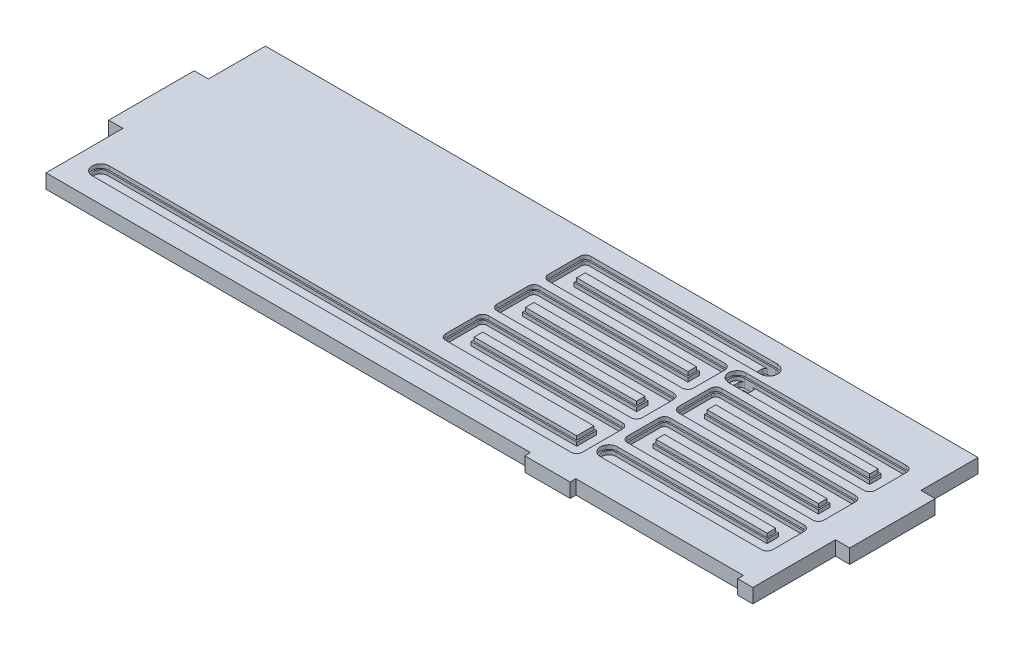
from build123d import *

# Parameters (mm, degrees)
EXTRUDE_1_DEPTH     = 50
CUT_EXTRUDE_1_DEPTH = 14
CUT_EXTRUDE_3_DEPTH = 27
CUT_EXTRUDE_4_DEPTH = 45
CUT_EXTRUDE_6_DEPTH = 50


with BuildPart() as part:
    # 草图1 → 凸台-拉伸1 (new body)
    with BuildSketch(Plane(origin=(0, 0, 0), x_dir=(1, 0, 0), z_dir=(0, 1, 0))):
        Polygon((0, 0), (0, -200), (-50, -200), (-50, -500), (0, -500), (0, -770), (1700, -770), (1700, -790), (1859, -790), (1859, -770), (2447, -770), (2447, -790), (2500, -790), (2500, -500), (2550, -500), (2550, -200), (2500, -200), (2500, 0), align=None)
    extrude(amount=-EXTRUDE_1_DEPTH)

    # 草图1<3> → 切除-拉伸1 (cut)
    with BuildSketch(Plane(origin=(0, 0, 0), x_dir=(1, 0, 0), z_dir=(0, 1, 0))):
        with BuildLine():
            Line((90, -698), (1770, -698))
            ThreePointArc((1770, -698), (1784.142135624, -692.142135624), (1790, -678))
            Line((1790, -678), (1790, -538))
            ThreePointArc((1790, -538), (1784.142135624, -523.857864376), (1770, -518))
            Line((1770, -518), (1250, -518))
            Line((1250, -518), (1250, -488))
            Line((1250, -488), (1770, -488))
            ThreePointArc((1770, -488), (1784.142135624, -482.142135624), (1790, -468))
            Line((1790, -468), (1790, -358))
            ThreePointArc((1790, -358), (1784.142135624, -343.857864376), (1770, -338))
            Line((1770, -338), (1250, -338))
            Line((1250, -338), (1250, -308))
            Line((1250, -308), (1770, -308))
            ThreePointArc((1770, -308), (1784.142135624, -302.142135624), (1790, -288))
            Line((1790, -288), (1790, -178))
            ThreePointArc((1790, -178), (1784.142135624, -163.857864376), (1770, -158))
            Line((1770, -158), (1250, -158))
            Line((1250, -158), (1250, -128))
            Line((1250, -128), (1865, -128))
            ThreePointArc((1865, -128), (1895, -98), (1865, -68))
            Line((1865, -68), (1210, -68))
            ThreePointArc((1210, -68), (1195.857864376, -73.857864376), (1190, -88))
            Line((1190, -88), (1190, -198))
            ThreePointArc((1190, -198), (1195.857864376, -212.142135624), (1210, -218))
            Line((1210, -218), (1730, -218))
            Line((1730, -218), (1730, -248))
            Line((1730, -248), (1210, -248))
            ThreePointArc((1210, -248), (1195.857864376, -253.857864376), (1190, -268))
            Line((1190, -268), (1190, -378))
            ThreePointArc((1190, -378), (1195.857864376, -392.142135624), (1210, -398))
            Line((1210, -398), (1730, -398))
            Line((1730, -398), (1730, -428))
            Line((1730, -428), (1210, -428))
            ThreePointArc((1210, -428), (1195.857864376, -433.857864376), (1190, -448))
            Line((1190, -448), (1190, -558))
            ThreePointArc((1190, -558), (1195.857864376, -572.142135624), (1210, -578))
            Line((1210, -578), (1730, -578))
            Line((1730, -578), (1730, -638))
            Line((1730, -638), (90, -638))
            ThreePointArc((90, -638), (60, -668), (90, -698))
        make_face()
        with BuildLine():
            Line((1835, -210), (2360, -210))
            Line((2360, -210), (2360, -240))
            Line((2360, -240), (1840, -240))
            ThreePointArc((1840, -240), (1825.857864376, -245.857864376), (1820, -260))
            Line((1820, -260), (1820, -370))
            ThreePointArc((1820, -370), (1825.857864376, -384.142135624), (1840, -390))
            Line((1840, -390), (2360, -390))
            Line((2360, -390), (2360, -420))
            Line((2360, -420), (1840, -420))
            ThreePointArc((1840, -420), (1825.857864376, -425.857864376), (1820, -440))
            Line((1820, -440), (1820, -550))
            ThreePointArc((1820, -550), (1825.857864376, -564.142135624), (1840, -570))
            Line((1840, -570), (2360, -570))
            Line((2360, -570), (2360, -600))
            Line((2360, -600), (1835, -600))
            ThreePointArc((1835, -600), (1805, -630), (1835, -660))
            Line((1835, -660), (2400, -660))
            ThreePointArc((2400, -660), (2414.142135624, -654.142135624), (2420, -640))
            Line((2420, -640), (2420, -530))
            ThreePointArc((2420, -530), (2414.142135624, -515.857864376), (2400, -510))
            Line((2400, -510), (1880, -510))
            Line((1880, -510), (1880, -480))
            Line((1880, -480), (2400, -480))
            ThreePointArc((2400, -480), (2414.142135624, -474.142135624), (2420, -460))
            Line((2420, -460), (2420, -350))
            ThreePointArc((2420, -350), (2414.142135624, -335.857864376), (2400, -330))
            Line((2400, -330), (1880, -330))
            Line((1880, -330), (1880, -300))
            Line((1880, -300), (2400, -300))
            ThreePointArc((2400, -300), (2414.142135624, -294.142135624), (2420, -280))
            Line((2420, -280), (2420, -170))
            ThreePointArc((2420, -170), (2414.142135624, -155.857864376), (2400, -150))
            Line((2400, -150), (1835, -150))
            ThreePointArc((1835, -150), (1805, -180), (1835, -210))
        make_face()
    extrude(amount=-CUT_EXTRUDE_1_DEPTH, mode=Mode.SUBTRACT)

    # 草图1<5> → 切除-拉伸3 (cut)
    with BuildSketch(Plane(origin=(0, 0, 0), x_dir=(1, 0, 0), z_dir=(0, 1, 0))):
        with BuildLine():
            Line((90, -693), (1770, -693))
            ThreePointArc((1770, -693), (1780.606601718, -688.606601718), (1785, -678))
            Line((1785, -678), (1785, -538))
            ThreePointArc((1785, -538), (1780.606601718, -527.393398282), (1770, -523))
            Line((1770, -523), (1245, -523))
            Line((1245, -523), (1245, -483))
            Line((1245, -483), (1770, -483))
            ThreePointArc((1770, -483), (1780.606601718, -478.606601718), (1785, -468))
            Line((1785, -468), (1785, -358))
            ThreePointArc((1785, -358), (1780.606601718, -347.393398282), (1770, -343))
            Line((1770, -343), (1245, -343))
            Line((1245, -343), (1245, -303))
            Line((1245, -303), (1770, -303))
            ThreePointArc((1770, -303), (1780.606601718, -298.606601718), (1785, -288))
            Line((1785, -288), (1785, -178))
            ThreePointArc((1785, -178), (1780.606601718, -167.393398282), (1770, -163))
            Line((1770, -163), (1245, -163))
            Line((1245, -163), (1245, -123))
            Line((1245, -123), (1865, -123))
            ThreePointArc((1865, -123), (1890, -98), (1865, -73))
            Line((1865, -73), (1210, -73))
            ThreePointArc((1210, -73), (1199.393398282, -77.393398282), (1195, -88))
            Line((1195, -88), (1195, -198))
            ThreePointArc((1195, -198), (1199.393398282, -208.606601718), (1210, -213))
            Line((1210, -213), (1735, -213))
            Line((1735, -213), (1735, -253))
            Line((1735, -253), (1210, -253))
            ThreePointArc((1210, -253), (1199.393398282, -257.393398282), (1195, -268))
            Line((1195, -268), (1195, -378))
            ThreePointArc((1195, -378), (1199.393398282, -388.606601718), (1210, -393))
            Line((1210, -393), (1735, -393))
            Line((1735, -393), (1735, -433))
            Line((1735, -433), (1210, -433))
            ThreePointArc((1210, -433), (1199.393398282, -437.393398282), (1195, -448))
            Line((1195, -448), (1195, -558))
            ThreePointArc((1195, -558), (1199.393398282, -568.606601718), (1210, -573))
            Line((1210, -573), (1735, -573))
            Line((1735, -573), (1735, -643))
            Line((1735, -643), (90, -643))
            ThreePointArc((90, -643), (65, -668), (90, -693))
        make_face()
        with BuildLine():
            Line((1835, -155), (2400, -155))
            ThreePointArc((2400, -155), (2410.606601718, -159.393398282), (2415, -170))
            Line((2415, -170), (2415, -280))
            ThreePointArc((2415, -280), (2410.606601718, -290.606601718), (2400, -295))
            Line((2400, -295), (1875, -295))
            Line((1875, -295), (1875, -335))
            Line((1875, -335), (2400, -335))
            ThreePointArc((2400, -335), (2410.606601718, -339.393398282), (2415, -350))
            Line((2415, -350), (2415, -460))
            ThreePointArc((2415, -460), (2410.606601718, -470.606601718), (2400, -475))
            Line((2400, -475), (1875, -475))
            Line((1875, -475), (1875, -515))
            Line((1875, -515), (2400, -515))
            ThreePointArc((2400, -515), (2410.606601718, -519.393398282), (2415, -530))
            Line((2415, -530), (2415, -640))
            ThreePointArc((2415, -640), (2410.606601718, -650.606601718), (2400, -655))
            Line((2400, -655), (1835, -655))
            ThreePointArc((1835, -655), (1810, -630), (1835, -605))
            Line((1835, -605), (2365, -605))
            Line((2365, -605), (2365, -565))
            Line((2365, -565), (1840, -565))
            ThreePointArc((1840, -565), (1829.393398282, -560.606601718), (1825, -550))
            Line((1825, -550), (1825, -440))
            ThreePointArc((1825, -440), (1829.393398282, -429.393398282), (1840, -425))
            Line((1840, -425), (2365, -425))
            Line((2365, -425), (2365, -385))
            Line((2365, -385), (1840, -385))
            ThreePointArc((1840, -385), (1829.393398282, -380.606601718), (1825, -370))
            Line((1825, -370), (1825, -260))
            ThreePointArc((1825, -260), (1829.393398282, -249.393398282), (1840, -245))
            Line((1840, -245), (2365, -245))
            Line((2365, -245), (2365, -205))
            Line((2365, -205), (1835, -205))
            ThreePointArc((1835, -205), (1810, -180), (1835, -155))
        make_face()
    extrude(amount=-CUT_EXTRUDE_3_DEPTH, mode=Mode.SUBTRACT)

    # 草图2 → 切除-拉伸4 (cut)
    with BuildSketch(Plane(origin=(0, 0, 0), x_dir=(1, 0, 0), z_dir=(0, 1, 0))):
        with BuildLine():
            Line((1865, -123), (1835, -123))
            ThreePointArc((1835, -123), (1827.928932188, -120.071067812), (1825, -113))
            Line((1825, -113), (1825, -83))
            ThreePointArc((1825, -83), (1827.928932188, -75.928932188), (1835, -73))
            Line((1835, -73), (1865, -73))
            ThreePointArc((1865, -73), (1872.071067812, -75.928932188), (1875, -83))
            Line((1875, -83), (1875, -113))
            ThreePointArc((1875, -113), (1872.071067812, -120.071067812), (1865, -123))
        make_face()
        with BuildLine():
            Line((1865, -205), (1835, -205))
            ThreePointArc((1835, -205), (1827.928932188, -202.071067812), (1825, -195))
            Line((1825, -195), (1825, -165))
            ThreePointArc((1825, -165), (1827.928932188, -157.928932188), (1835, -155))
            Line((1835, -155), (1865, -155))
            ThreePointArc((1865, -155), (1872.071067812, -157.928932188), (1875, -165))
            Line((1875, -165), (1875, -195))
            ThreePointArc((1875, -195), (1872.071067812, -202.071067812), (1865, -205))
        make_face()
    extrude(amount=-CUT_EXTRUDE_4_DEPTH, mode=Mode.SUBTRACT)

    # 草图2<4> → 切除-拉伸6 (cut)
    with BuildSketch(Plane(origin=(0, 0, 0), x_dir=(1, 0, 0), z_dir=(0, 1, 0))):
        with BuildLine():
            Line((1842.5, -115.5), (1857.5, -115.5))
            ThreePointArc((1857.5, -115.5), (1864.571067812, -112.571067812), (1867.5, -105.5))
            Line((1867.5, -105.5), (1867.5, -90.5))
            ThreePointArc((1867.5, -90.5), (1864.571067812, -83.428932188), (1857.5, -80.5))
            Line((1857.5, -80.5), (1842.5, -80.5))
            ThreePointArc((1842.5, -80.5), (1835.428932188, -83.428932188), (1832.5, -90.5))
            Line((1832.5, -90.5), (1832.5, -105.5))
            ThreePointArc((1832.5, -105.5), (1835.428932188, -112.571067812), (1842.5, -115.5))
        make_face()
        with BuildLine():
            Line((1842.5, -197.5), (1857.5, -197.5))
            ThreePointArc((1857.5, -197.5), (1864.571067812, -194.571067812), (1867.5, -187.5))
            Line((1867.5, -187.5), (1867.5, -172.5))
            ThreePointArc((1867.5, -172.5), (1864.571067812, -165.428932188), (1857.5, -162.5))
            Line((1857.5, -162.5), (1842.5, -162.5))
            ThreePointArc((1842.5, -162.5), (1835.428932188, -165.428932188), (1832.5, -172.5))
            Line((1832.5, -172.5), (1832.5, -187.5))
            ThreePointArc((1832.5, -187.5), (1835.428932188, -194.571067812), (1842.5, -197.5))
        make_face()
    extrude(amount=-CUT_EXTRUDE_6_DEPTH, mode=Mode.SUBTRACT)


solid = part.part
